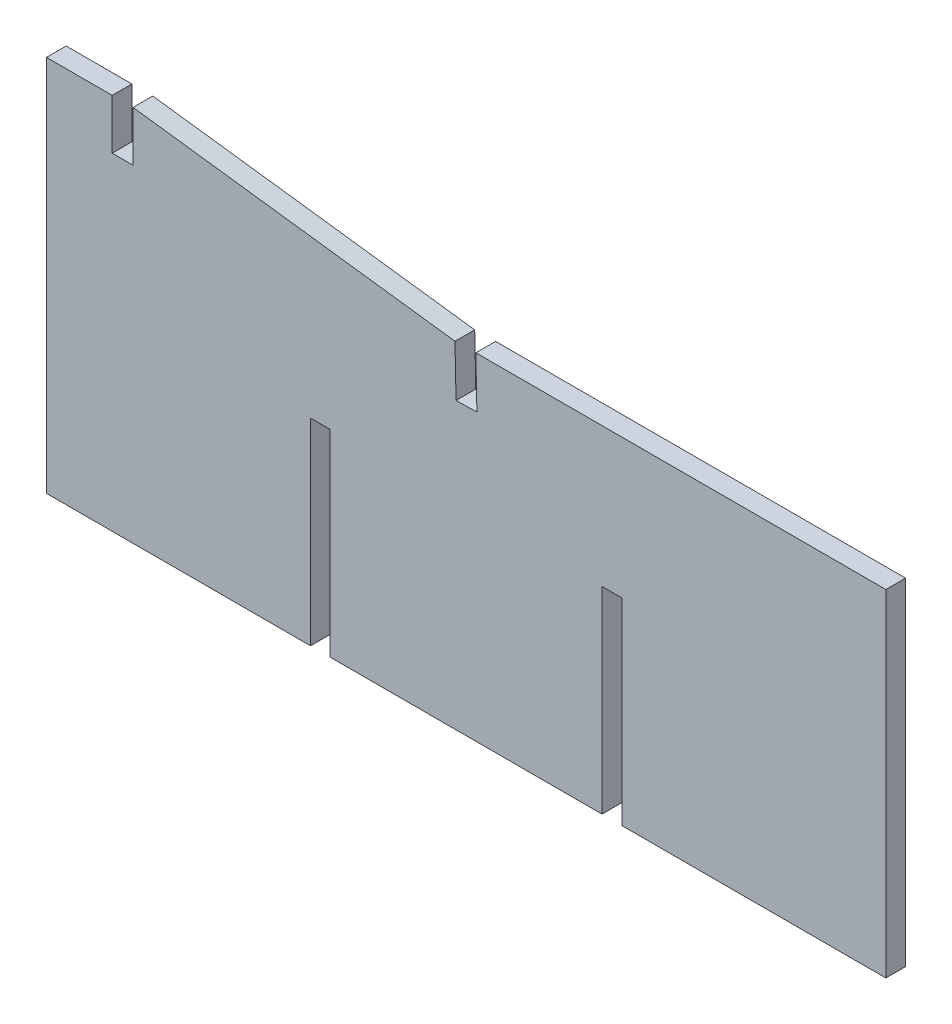
from build123d import *

# Parameters (mm, degrees)
BOSS_EXTRUDE1_DEPTH = 3


with BuildPart() as part:
    # Sketch1 → Boss-Extrude1 (new body)
    with BuildSketch(Plane.XY.offset(-196)):
        Polygon((266.676489805, 75.625558434), (269.851489805, 75.625558434), (269.851489805, 83.246308539), (318.827170369, 76.925634107), (318.987231093, 69.203006724), (322.161541781, 69.269229798), (322.001481344, 76.991843388), (384.372489805, 76.991843388), (384.372489805, 25.807642853), (344.197489805, 25.807642853), (344.197489805, 55.807642853), (341.197489805, 55.807642853), (341.197489805, 25.807642853), (299.851489805, 25.807642853), (299.851489805, 55.807642853), (296.851489805, 55.807642853), (296.851489805, 25.807642853), (256.676489805, 25.807642853), (256.676489805, 83.246307123), (266.676489805, 83.246307123), align=None)
    extrude(amount=BOSS_EXTRUDE1_DEPTH)


solid = part.part
